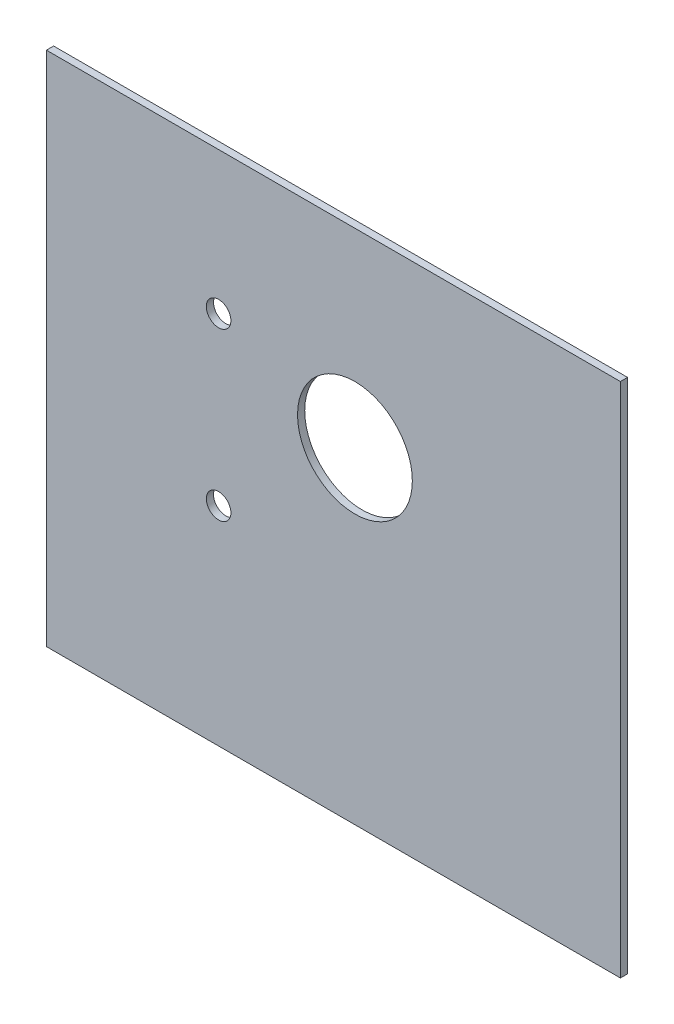
from build123d import *

# Parameters (mm, degrees)
ESQUISSE1_W             = 400
ESQUISSE1_H             = 360
BOSS_EXTRU_1_DEPTH      = 5
ESQUISSE5_R             = 8.56
ENL_V_MAT_EXTRU_3_DEPTH = 10
ESQUISSE6_R             = 40
ENL_V_MAT_EXTRU_4_DEPTH = 10


with BuildPart() as part:
    # Esquisse1 → Boss.-Extru.1 (new body)
    with BuildSketch(Plane.XY):
        Rectangle(ESQUISSE1_W, ESQUISSE1_H)
    extrude(amount=BOSS_EXTRU_1_DEPTH)

    # Esquisse5 → Enlèv. mat.-Extru.3 (cut)
    with BuildSketch(Plane(origin=(0, 0, 0), x_dir=(-1, 0, 0), z_dir=(0, 0, -1))):
        with Locations((80, 81)):
            Circle(ESQUISSE5_R)
        with Locations((80, -35)):
            Circle(ESQUISSE5_R)
    extrude(amount=-ENL_V_MAT_EXTRU_3_DEPTH, mode=Mode.SUBTRACT)

    # Esquisse6 → Enlèv. mat.-Extru.4 (cut)
    with BuildSketch(Plane(origin=(0, 0, 0), x_dir=(-1, 0, 0), z_dir=(0, 0, -1))):
        with Locations((-15, 47.5)):
            Circle(ESQUISSE6_R)
    extrude(amount=-ENL_V_MAT_EXTRU_4_DEPTH, mode=Mode.SUBTRACT)


solid = part.part
